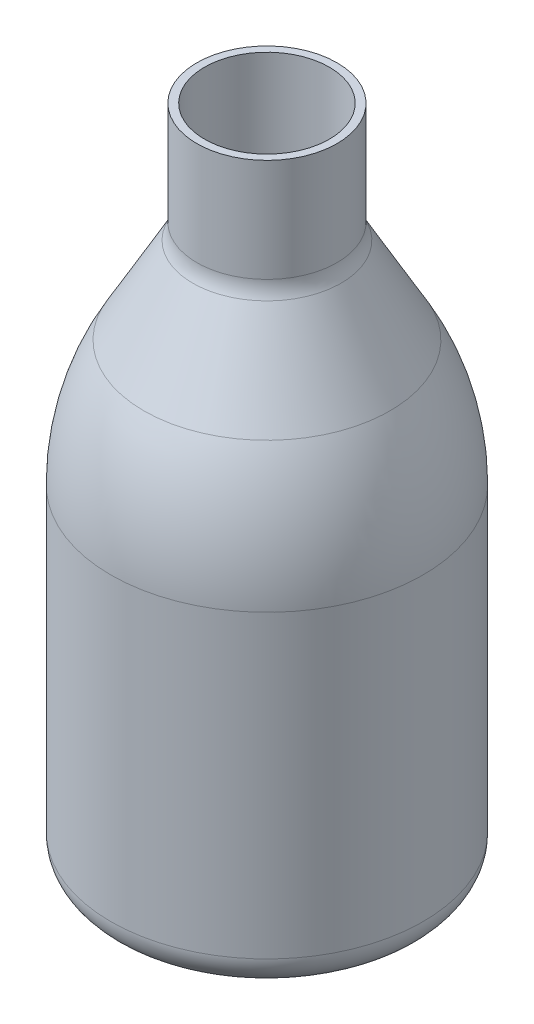
from build123d import *

# Parameters (mm, degrees)
FILLET1_R = 6.35
FILLET2_R = 50.8
SHELL1_T  = -1.524


with BuildPart() as part:
    # Sketch1 → Revolve1 (revolve)
    with BuildSketch(Plane.XY, mode=Mode.PRIVATE) as revolve1_sk:
        Polygon((0, 0), (0, 132.08), (-13.97, 132.08), (-13.97, 109.855), (-31.115, 79.574510135), (-31.115, 0), align=None)
    revolve(revolve1_sk.sketch.rotate(Axis((0, 0, 0), (0, 1, 0)), 270), axis=Axis((0, 0, 0), (0, 1, 0)))

    # Fillet1
    fillet1_edges = [part.edges().sort_by_distance(p)[0] for p in [
        (0, 109.855, 13.97),
        (0, 0, 31.115),
    ]]
    fillet(fillet1_edges, radius=FILLET1_R)

    # Fillet2
    fillet2_edges = [part.edges().sort_by_distance(p)[0] for p in [
        (0, 79.574510135, 31.115),
    ]]
    fillet(fillet2_edges, radius=FILLET2_R)

    # Shell1
    shell1_openings = [part.faces().sort_by_distance(p)[0] for p in [
        (0, 132.08, 0),
    ]]
    offset(amount=SHELL1_T, openings=shell1_openings, kind=Kind.INTERSECTION)


solid = part.part
